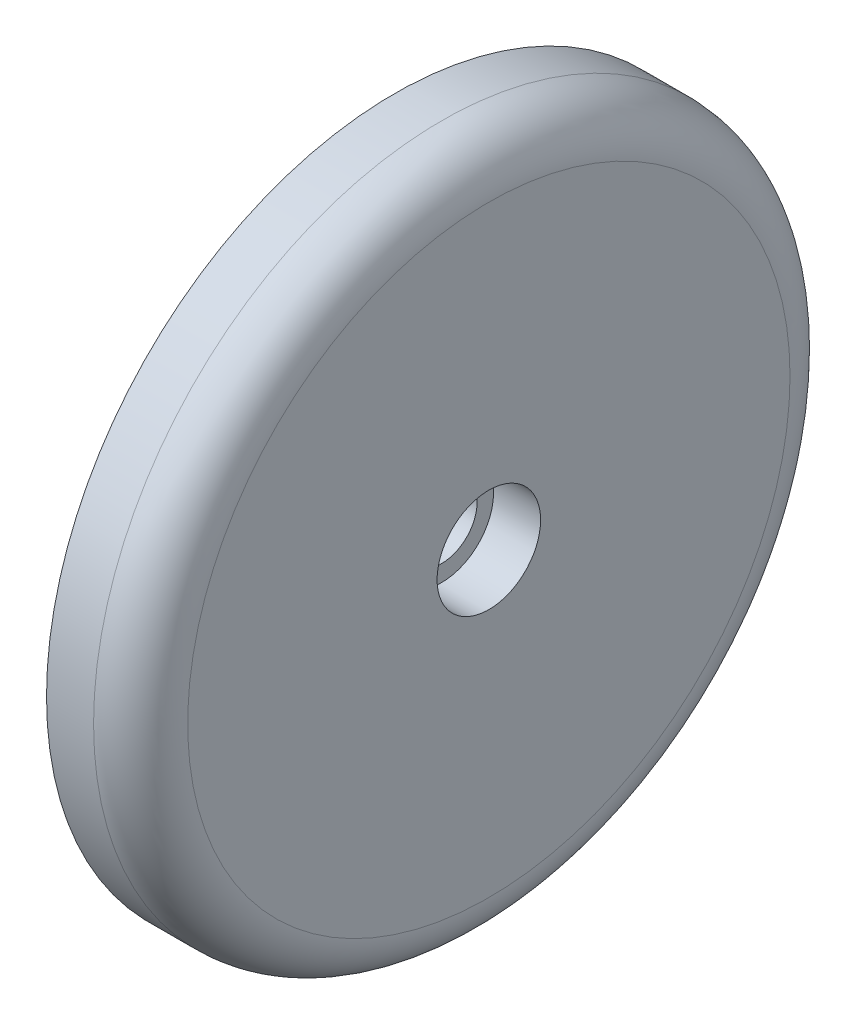
from build123d import *

# Parameters (mm, degrees)
ENL_V_START             = -4
ENL_V_MAT_EXTRU_6_DEPTH = 4
CONG_3_R                = 1
CONG_2_R                = 2
BOSS_EXTRU_1_DEPTH      = 0.5


with BuildPart() as part:
    # Esquisse1 → Révolution1 (revolve)
    with BuildSketch(Plane.XY, mode=Mode.PRIVATE) as r_volution1_sk:
        Polygon((-20.786263106, 2.2), (-22.786263106, 2.2), (-22.786263106, 1.5), (-27.786263106, 1.5), (-27.786263106, 4), (-21.786263106, 4), (-21.786263106, 12), (-25.786263106, 12), (-25.786263106, 13), (-24.786263106, 13), (-24.786263106, 14.8), (-20.786263106, 14.8), align=None)
    revolve(r_volution1_sk.sketch.rotate(Axis((0, 0, 0), (-1, 0, 0)), 90), axis=Axis((0, 0, 0), (-1, 0, 0)))

    # Esquisse2 → Enlèv. mat.-Extru.6 (cut)
    with BuildSketch(Plane.ZY.offset(25.786263106).offset(ENL_V_START)):
        with BuildLine():
            Line((-12.369316877, 4), (-9.418154919, 4))
            Line((-9.418154919, 4), (-9.418154919, -4))
            Line((-9.418154919, -4), (-12.369316877, -4))
            ThreePointArc((-12.369316877, -4), (-13, 0), (-12.369316877, 4))
        make_face()
        with BuildLine():
            Line((9.418154919, 4), (9.418154919, -4))
            Line((9.418154919, -4), (12.369316877, -4))
            ThreePointArc((12.369316877, -4), (13, 0), (12.369316877, 4))
            Line((12.369316877, 4), (9.418154919, 4))
        make_face()
    extrude(amount=ENL_V_MAT_EXTRU_6_DEPTH, mode=Mode.SUBTRACT)

    # Congé3
    cong_3_edges = [part.edges().sort_by_distance(p)[0] for p in [
        (-21.786263106, -4, -11.841512688),
        (-21.786263106, 0, -13),
        (-21.786263106, 4, -11.841512688),
        (-21.786263106, 12, 0),
        (-21.786263106, 4, 11.841512688),
        (-21.786263106, 0, 13),
        (-21.786263106, -4, 11.841512688),
        (-21.786263106, -12, 0),
    ]]
    fillet(cong_3_edges, radius=CONG_3_R)

    # Congé2
    cong_2_edges = [part.edges().sort_by_distance(p)[0] for p in [
        (-20.786263106, 0, 14.8),
    ]]
    fillet(cong_2_edges, radius=CONG_2_R)

    # Esquisse3 → Boss.-Extru.1 (add)
    # profile 1 of 9: a face of its own
    with BuildSketch(Plane.ZY.offset(21.786263106)):
        with BuildLine():
            Line((8.819843942, 1.825507665), (8.941597188, 1.121773899))
            Line((8.941597188, 1.121773899), (8.36854524, 1.138007665))
            add(Edge.make_bspline(
                [(8.36854524, 1.138007665), (8.422780172, 1.114210338), (8.52682355, 1.068557947), (8.670469402, 0.989681298), (8.795654722, 0.905395931), (8.902234139, 0.815352011), (8.989841791, 0.719102999), (9.056973092, 0.616125655), (9.107874937, 0.508455472), (9.124775313, 0.432275972), (9.13315563, 0.394501172)],
                knots=[0, 0, 0, 0, 1.276426515, 2.448675106, 3.527824085, 4.524966553, 5.450229124, 6.322273777, 7.168073133, 8, 8, 8, 8], degree=3))
            add(Edge.make_bspline(
                [(9.13315563, 0.394501172), (9.136755444, 0.366949389), (9.144144854, 0.310393303), (9.143379927, 0.22189203), (9.133827696, 0.128329998), (9.120000649, 0.065117255), (9.112863422, 0.032488185)],
                knots=[0, 0, 0, 0, 0.912789854, 1.873701611, 2.902450107, 4, 4, 4, 4], degree=3))
            Line((9.112863422, 0.032488185), (8.431856929, 0.211059613))
            add(Edge.make_bspline(
                [(8.431856929, 0.211059613), (8.436703541, 0.247584557), (8.44646801, 0.321171345), (8.436750921, 0.394770674), (8.431856929, 0.431838834)],
                knots=[0, 0, 0, 0, 0.992703866, 2, 2, 2, 2], degree=3))
            add(Edge.make_bspline(
                [(8.431856929, 0.431838834), (8.425729809, 0.460521524), (8.413533178, 0.517617219), (8.379107039, 0.598263178), (8.334260959, 0.67486849), (8.295190774, 0.719751646), (8.275201084, 0.742715458)],
                knots=[0, 0, 0, 0, 0.995120535, 1.980884572, 2.966949049, 4, 4, 4, 4], degree=3))
            add(Edge.make_bspline(
                [(8.275201084, 0.742715458), (8.242537258, 0.775653653), (8.177619075, 0.841117134), (8.064906554, 0.921035137), (7.943973158, 0.987066767), (7.833944481, 1.028029312), (7.737234093, 1.053319792), (7.653328501, 1.071275344), (7.558475686, 1.086352334), (7.452569069, 1.099072883), (7.335645721, 1.11032013), (7.207392973, 1.120125964), (7.06801049, 1.127349379), (6.971366366, 1.130092981), (6.92130498, 1.131514159)],
                knots=[0, 0, 0, 0, 1.148958866, 2.283514484, 3.41277613, 4.559772639, 5.184989156, 5.891949701, 6.687575455, 7.566757255, 8.537884266, 9.601480352, 10.757573552, 12, 12, 12, 12], degree=3))
            Line((6.92130498, 1.131514159), (5.99354524, 1.162358315))
            Line((5.99354524, 1.162358315), (5.864486799, 1.913170003))
            Line((5.864486799, 1.913170003), (8.819843942, 1.825507665))
        make_face()
    # profile 2 of 9: a face of its own
    with BuildSketch(Plane.ZY.offset(21.786263106)):
        with BuildLine():
            Line((8.572702432, 3.118576408), (8.01101412, 2.951368616))
            Line((8.01101412, 2.951368616), (7.756955679, 3.427017967))
            Line((7.756955679, 3.427017967), (5.479358276, 2.75250498))
            Line((5.479358276, 2.75250498), (5.119780354, 3.426206278))
            Line((5.119780354, 3.426206278), (7.39575438, 4.103966019))
            Line((7.39575438, 4.103966019), (7.195267367, 4.478966019))
            Line((7.195267367, 4.478966019), (7.756955679, 4.646173811))
            Line((7.756955679, 4.646173811), (7.957442692, 4.270362123))
            Line((7.957442692, 4.270362123), (8.248838796, 4.356401084))
            add(Edge.make_bspline(
                [(8.248838796, 4.356401084), (8.280727779, 4.365731447), (8.341906649, 4.383631707), (8.430638912, 4.407332086), (8.512384575, 4.426787731), (8.587321734, 4.442497027), (8.655550383, 4.453865783), (8.717265142, 4.461800114), (8.772353385, 4.463887401), (8.836331687, 4.463482054), (8.911362223, 4.451730215), (8.997612322, 4.425071074), (9.080773721, 4.383983027), (9.161353258, 4.331332336), (9.23730663, 4.264904178), (9.309803156, 4.187263546), (9.37509425, 4.095743323), (9.413382576, 4.028831777), (9.433092043, 3.994388097)],
                knots=[0, 0, 0, 0, 1.148051678, 2.202531958, 3.17306362, 4.05131355, 4.847453953, 5.562935404, 6.19927935, 6.750943993, 7.771645826, 8.809542764, 9.859038079, 10.966242176, 12.126297821, 13.336935954, 14.629149495, 16, 16, 16, 16], degree=3))
            add(Edge.make_bspline(
                [(9.433092043, 3.994388097), (9.459800622, 3.940717837), (9.514068019, 3.831668781), (9.577925378, 3.656786871), (9.631617308, 3.471090728), (9.656009093, 3.342035422), (9.668481653, 3.276043941)],
                knots=[0, 0, 0, 0, 0.947177648, 1.924507694, 2.938712278, 4, 4, 4, 4], degree=3))
            Line((9.668481653, 3.276043941), (9.105169965, 3.141303681))
            add(Edge.make_bspline(
                [(9.105169965, 3.141303681), (9.09745977, 3.186903383), (9.082951987, 3.272705443), (9.052284226, 3.391779914), (9.019944271, 3.49463925), (8.991076455, 3.554976601), (8.9777349, 3.582862123)],
                knots=[0, 0, 0, 0, 1.202236959, 2.262172898, 3.196845509, 4, 4, 4, 4], degree=3))
            add(Edge.make_bspline(
                [(8.9777349, 3.582862123), (8.968820096, 3.598134801), (8.951681133, 3.627496959), (8.917564311, 3.664143049), (8.87818924, 3.691742749), (8.848700279, 3.702515854), (8.834066068, 3.707862123)],
                knots=[0, 0, 0, 0, 1.082170538, 2.080503696, 3.047429546, 4, 4, 4, 4], degree=3))
            add(Edge.make_bspline(
                [(8.834066068, 3.707862123), (8.827333673, 3.709445623), (8.812147032, 3.713017614), (8.786090664, 3.713101564), (8.754710773, 3.710302079), (8.717879847, 3.705378167), (8.675195294, 3.698320592), (8.627540516, 3.686264112), (8.573923889, 3.672650293), (8.53642674, 3.66221615), (8.516695939, 3.656725759)],
                knots=[0, 0, 0, 0, 0.510828626, 1.152304726, 1.916054958, 2.84553417, 3.902914307, 5.117883771, 6.48344572, 8, 8, 8, 8], degree=3))
            Line((8.516695939, 3.656725759), (8.317020614, 3.597472512))
            Line((8.317020614, 3.597472512), (8.572702432, 3.118576408))
        make_face()
    # profile 3 of 9: a face of its own
    with BuildSketch(Plane.ZY.offset(21.786263106)):
        Polygon((4.767321934, 5.009988483), (5.281120635, 4.46859238), (4.626899856, 4.060313159), (4.113101155, 4.601709263), align=None)
    # profile 4 of 9: a face of its own
    with BuildSketch(Plane.ZY.offset(21.786263106)):
        Polygon((3.126734187, 6.074209009), (1.746864057, 6.738170048), (2.151896525, 7.27063758), (5.147838083, 8.638332385), (5.737123798, 8.354241476), (4.185987434, 6.303916801), (4.608877044, 6.100183035), (4.19735107, 5.558786931), (3.77446146, 5.761709009), (3.268779642, 5.099371346), (2.621052369, 5.411059658), align=None)
        Polygon((3.538260161, 6.615605113), (4.306928993, 7.630215502), (2.841019902, 6.950832385), align=None, mode=Mode.SUBTRACT)
    # profile 5 of 9: a face of its own
    with BuildSketch(Plane.ZY.offset(21.786263106)):
        with BuildLine():
            Line((-0.515985243, 8.08525568), (-1.259491737, 8.122593342))
            add(Edge.make_bspline(
                [(-1.259491737, 8.122593342), (-1.249148551, 8.155767978), (-1.22879702, 8.221043284), (-1.190443574, 8.314782289), (-1.145762658, 8.402814661), (-1.094458218, 8.485131891), (-1.036891559, 8.561499532), (-0.972778274, 8.631829163), (-0.903242426, 8.697107877), (-0.826335513, 8.755300281), (-0.744213306, 8.808648045), (-0.655620419, 8.854444788), (-0.5618334, 8.894622542), (-0.462293128, 8.92747311), (-0.357332199, 8.955757612), (-0.246127849, 8.975022269), (-0.12971159, 8.990360588), (-0.050124014, 8.994611442), (-0.009491737, 8.996781654)],
                knots=[0, 0, 0, 0, 1.013650469, 1.994485956, 2.951356175, 3.891170039, 4.821216655, 5.737863122, 6.665191425, 7.600017741, 8.548283102, 9.519410902, 10.506328362, 11.522466245, 12.575713468, 13.675201783, 14.813108165, 16, 16, 16, 16], degree=3))
            add(Edge.make_bspline(
                [(-0.009491737, 8.996781654), (0.031633859, 8.997848905), (0.111763176, 8.999928343), (0.228670058, 8.994220008), (0.338451762, 8.981185529), (0.441217688, 8.962231091), (0.536656222, 8.935077768), (0.625545108, 8.902219644), (0.707321709, 8.861571633), (0.781180453, 8.813322535), (0.847970769, 8.760176916), (0.905793001, 8.701196965), (0.955995721, 8.638327399), (0.997820063, 8.570252243), (1.031151587, 8.497195654), (1.055234705, 8.419395187), (1.072303034, 8.337303768), (1.075644901, 8.280688972), (1.077358912, 8.251651784)],
                knots=[0, 0, 0, 0, 1.33010659, 2.59158633, 3.781096061, 4.903410669, 5.967095821, 6.986079283, 7.964352745, 8.913308257, 9.834341162, 10.719124476, 11.578670078, 12.431060128, 13.296420284, 14.168127264, 15.060449952, 16, 16, 16, 16], degree=3))
            add(Edge.make_bspline(
                [(1.077358912, 8.251651784), (1.078003581, 8.208082039), (1.07933893, 8.117832975), (1.071239426, 8.01298502), (1.060485761, 7.932635994), (1.052439193, 7.873600355), (1.040750798, 7.799283053), (1.027263549, 7.709095139), (1.009931461, 7.603347952), (0.989881576, 7.482094024), (0.965893859, 7.345311585), (0.949598869, 7.248955439), (0.940995276, 7.198080355)],
                knots=[0, 0, 0, 0, 1.228135981, 2.5439241, 2.959291997, 3.51379255, 4.223663698, 5.080263802, 6.084781629, 7.244790872, 8.545277057, 10, 10, 10, 10], degree=3))
            add(Edge.make_bspline(
                [(0.940995276, 7.198080355), (0.933471831, 7.155908166), (0.919026004, 7.074933004), (0.901715734, 6.957867526), (0.885853936, 6.850816718), (0.87377653, 6.753656131), (0.864462292, 6.666534955), (0.859185399, 6.589367143), (0.85486431, 6.522250186), (0.856041443, 6.480822173), (0.856579692, 6.461879057)],
                knots=[0, 0, 0, 0, 1.385409505, 2.660135957, 3.827136998, 4.885396668, 5.826659669, 6.660232778, 7.387386364, 8, 8, 8, 8], degree=3))
            add(Edge.make_bspline(
                [(0.856579692, 6.461879057), (0.858462515, 6.429623776), (0.862308924, 6.363729654), (0.878852698, 6.263543941), (0.901067805, 6.159265568), (0.922085111, 6.089452052), (0.932878393, 6.053599836)],
                knots=[0, 0, 0, 0, 0.930257713, 1.900418011, 2.92177518, 4, 4, 4, 4], degree=3))
            Line((0.932878393, 6.053599836), (0.198300471, 6.025190745))
            add(Edge.make_bspline(
                [(0.198300471, 6.025190745), (0.18279348, 6.078465558), (0.151581321, 6.185696027), (0.137843077, 6.296531521), (0.130930341, 6.352301135)],
                knots=[0, 0, 0, 0, 0.99365065, 2, 2, 2, 2], degree=3))
            add(Edge.make_bspline(
                [(0.130930341, 6.352301135), (0.10362483, 6.320668152), (0.049786605, 6.258297457), (-0.040137896, 6.1744352), (-0.138072822, 6.103419289), (-0.240813081, 6.042214455), (-0.347408368, 5.993906678), (-0.455062931, 5.957805043), (-0.563200067, 5.934232091), (-0.635736946, 5.928845165), (-0.671829399, 5.926164771)],
                knots=[0, 0, 0, 0, 1.070796116, 2.111286761, 3.143421406, 4.166426702, 5.172121014, 6.137195861, 7.0731174, 8, 8, 8, 8], degree=3))
            add(Edge.make_bspline(
                [(-0.671829399, 5.926164771), (-0.699702914, 5.926015951), (-0.754746191, 5.925722067), (-0.835910107, 5.932531378), (-0.913655811, 5.94876262), (-0.988854844, 5.969962818), (-1.060202849, 6.000745509), (-1.129270207, 6.037009203), (-1.193920618, 6.082278301), (-1.255717713, 6.133122761), (-1.312532753, 6.190382247), (-1.362084426, 6.254037169), (-1.404621882, 6.322579399), (-1.439504548, 6.396255622), (-1.468025805, 6.474779931), (-1.490155702, 6.5583485), (-1.503662367, 6.647369451), (-1.507519931, 6.708320917), (-1.509491737, 6.739476459)],
                knots=[0, 0, 0, 0, 1.020912126, 2.016048219, 2.976268656, 3.92656553, 4.872718497, 5.817208811, 6.779422098, 7.757833696, 8.746035648, 9.727454666, 10.706618985, 11.695218484, 12.70796724, 13.763323029, 14.856715199, 16, 16, 16, 16], degree=3))
            add(Edge.make_bspline(
                [(-1.509491737, 6.739476459), (-1.510072368, 6.775200665), (-1.511204595, 6.844862695), (-1.503177376, 6.946529939), (-1.486251463, 7.042292696), (-1.460277106, 7.13178535), (-1.425964937, 7.215337517), (-1.383534409, 7.293101155), (-1.332560727, 7.365094786), (-1.291969568, 7.40742667), (-1.271667062, 7.428599836)],
                knots=[0, 0, 0, 0, 1.140431438, 2.223835792, 3.250826065, 4.24058256, 5.193608782, 6.129285326, 7.064323456, 8, 8, 8, 8], degree=3))
            add(Edge.make_bspline(
                [(-1.271667062, 7.428599836), (-1.249087705, 7.44886201), (-1.202584984, 7.490592438), (-1.122126475, 7.545279241), (-1.029669538, 7.592321261), (-0.927029358, 7.635772017), (-0.812752865, 7.672456289), (-0.687713237, 7.705236672), (-0.550881308, 7.730678979), (-0.455712001, 7.743425022), (-0.406407321, 7.750028407)],
                knots=[0, 0, 0, 0, 0.775215065, 1.596573777, 2.478551924, 3.424304848, 4.443884263, 5.544735628, 6.727993027, 8, 8, 8, 8], degree=3))
            add(Edge.make_bspline(
                [(-0.406407321, 7.750028407), (-0.363375593, 7.755616912), (-0.280767498, 7.766345176), (-0.162755829, 7.783172652), (-0.055904351, 7.800410805), (0.039783416, 7.816911279), (0.124405833, 7.835017966), (0.197865193, 7.852454433), (0.260267755, 7.870079779), (0.297388256, 7.883499094), (0.314371899, 7.889638797)],
                knots=[0, 0, 0, 0, 1.415878507, 2.718064826, 3.889328383, 4.947427709, 5.885881394, 6.712394192, 7.41088515, 8, 8, 8, 8], degree=3))
            add(Edge.make_bspline(
                [(0.314371899, 7.889638797), (0.32061531, 7.916366128), (0.332354403, 7.966619854), (0.344519624, 8.038146298), (0.35189912, 8.100788288), (0.351769306, 8.139622944), (0.351709562, 8.15749594)],
                knots=[0, 0, 0, 0, 1.214164383, 2.282917155, 3.2097416, 4, 4, 4, 4], degree=3))
            add(Edge.make_bspline(
                [(0.351709562, 8.15749594), (0.34980002, 8.178563294), (0.346094297, 8.219447331), (0.322692082, 8.276241499), (0.288009897, 8.326756003), (0.238834001, 8.367605297), (0.180257239, 8.401317462), (0.111182754, 8.423563828), (0.033786017, 8.436989883), (-0.020796565, 8.436276894), (-0.049264464, 8.435905031)],
                knots=[0, 0, 0, 0, 0.923252309, 1.791695346, 2.661030215, 3.586720964, 4.570195197, 5.609936543, 6.753446898, 8, 8, 8, 8], degree=3))
            add(Edge.make_bspline(
                [(-0.049264464, 8.435905031), (-0.080474282, 8.433738471), (-0.139931946, 8.429610969), (-0.22433185, 8.410912965), (-0.298385116, 8.381636857), (-0.363964384, 8.343629691), (-0.416871953, 8.29243512), (-0.461992999, 8.233378237), (-0.495427212, 8.163001964), (-0.508973963, 8.111770915), (-0.515985243, 8.08525568)],
                knots=[0, 0, 0, 0, 1.179174094, 2.246438542, 3.245327271, 4.174846122, 5.084710472, 6.003349471, 6.966609888, 8, 8, 8, 8], degree=3))
        make_face()
        with BuildLine():
            add(Edge.make_bspline(
                [(0.234014757, 7.384768667), (0.207030351, 7.377425593), (0.146446369, 7.360939305), (0.084775537, 7.3491173), (0.050573198, 7.342560875)],
                knots=[0, 0, 0, 0, 0.890809893, 2, 2, 2, 2], degree=3))
            add(Edge.make_bspline(
                [(0.050573198, 7.342560875), (0.008316833, 7.335527253), (-0.072622486, 7.322054807), (-0.18788516, 7.298456643), (-0.291675247, 7.273839356), (-0.384799003, 7.250492095), (-0.465511774, 7.22343965), (-0.535274237, 7.19671959), (-0.594236863, 7.16981407), (-0.655401979, 7.131889425), (-0.715686178, 7.079286891), (-0.767452905, 7.005654535), (-0.797616005, 6.922459368), (-0.799245044, 6.86417812), (-0.800076153, 6.834443992)],
                knots=[0, 0, 0, 0, 1.422011572, 2.723770663, 3.904611611, 4.963412212, 5.909247401, 6.728229269, 7.443406871, 8.056550521, 9.112757327, 10.074494285, 11.017638858, 12, 12, 12, 12], degree=3))
            add(Edge.make_bspline(
                [(-0.800076153, 6.834443992), (-0.798090197, 6.811259696), (-0.794243049, 6.766347608), (-0.772200454, 6.703413511), (-0.739276641, 6.64746531), (-0.694195179, 6.600566425), (-0.640397746, 6.563036652), (-0.579201444, 6.536488008), (-0.51145685, 6.522865182), (-0.464633889, 6.522257323), (-0.44049823, 6.521943992)],
                knots=[0, 0, 0, 0, 1.042208828, 2.018943186, 2.967803478, 3.939757519, 4.918004553, 5.898365412, 6.916678217, 8, 8, 8, 8], degree=3))
            add(Edge.make_bspline(
                [(-0.44049823, 6.521943992), (-0.41443715, 6.523696296), (-0.362343035, 6.527199018), (-0.285653351, 6.54475563), (-0.211228095, 6.57203107), (-0.139533201, 6.607469175), (-0.071953305, 6.650630854), (-0.01261338, 6.70337354), (0.039990883, 6.762283311), (0.08659819, 6.830501073), (0.126143329, 6.913967958), (0.160056972, 7.016638376), (0.191895324, 7.140200912), (0.207152543, 7.230667247), (0.215345925, 7.279249186)],
                knots=[0, 0, 0, 0, 0.85057619, 1.700236995, 2.554146016, 3.429964657, 4.303470079, 5.15988157, 6.009679745, 6.87337497, 7.843939025, 9.010044869, 10.394343935, 12, 12, 12, 12], degree=3))
            Line((0.215345925, 7.279249186), (0.234014757, 7.384768667))
        make_face(mode=Mode.SUBTRACT)
    # profile 6 of 9: a face of its own
    with BuildSketch(Plane.ZY.offset(21.786263106)):
        Polygon((-3.04338412, 6.211236931), (-2.355072432, 6.506691477), (-2.199228276, 5.75019797), (-2.887539964, 5.454743425), align=None)
    # profile 7 of 9: a face of its own
    with BuildSketch(Plane.ZY.offset(21.786263106)):
        Polygon((-3.737450687, 4.625290491), (-4.200113025, 4.081459322), (-5.696054583, 5.171556724), (-4.847028609, 3.320907374), (-5.304009129, 2.7843814), (-7.74069744, 4.396394387), (-7.30319744, 4.910193088), (-5.695242895, 3.799803478), (-6.607580557, 5.727563218), (-6.160340298, 6.253537244), (-4.616509129, 5.066848932), (-5.531281856, 6.992173607), (-5.037775363, 7.57253075), align=None)
    # profile 8 of 9: a face of its own
    with BuildSketch(Plane.ZY.offset(21.786263106)):
        Polygon((-5.813835346, 1.246932047), (-5.832504178, 0.535081397), (-7.688835346, 0.444983995), (-5.858478204, -0.460048473), (-5.877147035, -1.162158862), (-8.795166515, -1.438132888), (-8.778121061, -0.76443159), (-6.82195223, -0.618327694), (-8.74971197, 0.304561917), (-8.731854827, 0.994496982), (-6.778932749, 1.040763216), (-8.706692489, 1.960406073), (-8.686400281, 2.720958021), align=None)
    # profile 9 of 9: a face of its own
    with BuildSketch(Plane.ZY.offset(21.786263106)):
        Polygon((-5.301634309, -2.679214645), (-4.869816127, -3.245773087), (-6.261049893, -4.478727632), (-4.266731711, -4.03716919), (-3.841407036, -4.595610749), (-5.94530314, -6.639441918), (-6.353582361, -6.103727632), (-4.919329114, -4.765253606), (-7.000497945, -5.25388997), (-7.418517426, -4.705188671), (-5.925010932, -3.445448411), (-8.004556387, -3.93651984), (-8.46478366, -3.331812048), align=None)
    extrude(amount=BOSS_EXTRU_1_DEPTH)


solid = part.part
